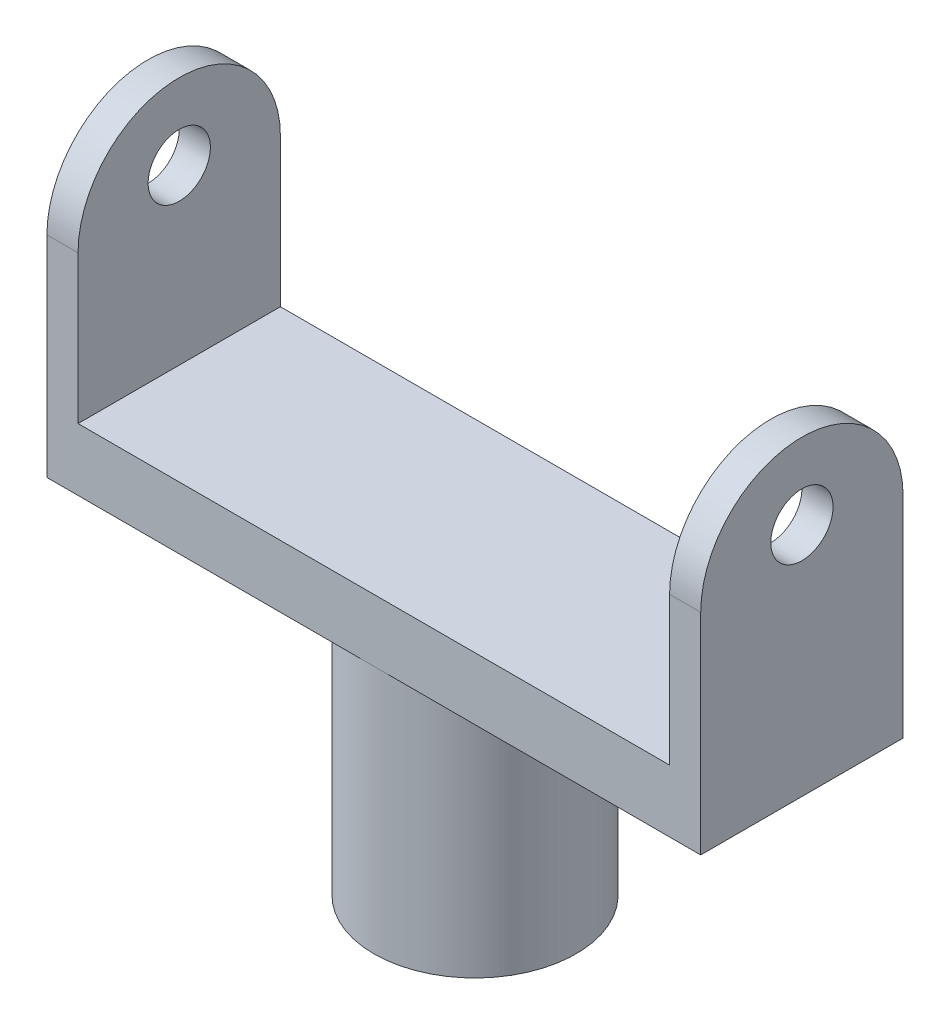
from build123d import *

# Parameters (mm, degrees)
SKETCH1_R               = 3.25
SKETCH1_R_2             = 2.75
BOSS_EXTRUDE1_DEPTH     = 8
SKETCH2_W               = 21
SKETCH2_H               = 6.5
BOSS_EXTRUDE2_DEPTH     = 2
SKETCH3_W               = 1
SKETCH3_H               = 6.5
BOSS_EXTRUDE3_DEPTH     = 8
CUT_EXTRUDE1_DEPTH      = 28.84892278
CUT_EXTRUDE1_DEPTH_BACK = 28.84892278
SKETCH4_R               = 1
FILLET1_RADIUS          = 3.25
FILLET1_LENGTH          = 1
FILLET2_RADIUS          = 3.25
FILLET2_LENGTH          = 1


with BuildPart() as part:
    # Sketch1 → Boss-Extrude1 (new body)
    with BuildSketch(Plane(origin=(0, 0, 0), x_dir=(1, 0, 0), z_dir=(0, 1, 0))):
        with Locations(Location((0, 0, 0), (0, 0, 270))):
            Circle(SKETCH1_R)
        with Locations(Location((0, 0, 0), (0, 0, 270))):
            Circle(SKETCH1_R_2, mode=Mode.SUBTRACT)
    extrude(amount=BOSS_EXTRUDE1_DEPTH)

    # Sketch2 → Boss-Extrude2 (add)
    with BuildSketch(Plane(origin=(0, 8, 0), x_dir=(1, 0, 0), z_dir=(0, 1, 0))):
        Rectangle(SKETCH2_W, SKETCH2_H)
    extrude(amount=BOSS_EXTRUDE2_DEPTH)

    # Sketch3 → Boss-Extrude3 (add)
    with BuildSketch(Plane(origin=(0, 10, 0), x_dir=(1, 0, 0), z_dir=(0, 1, 0))):
        with Locations((-10, 0)):
            Rectangle(SKETCH3_W, SKETCH3_H)
        with Locations((10, 0)):
            Rectangle(SKETCH3_W, SKETCH3_H)
    extrude(amount=BOSS_EXTRUDE3_DEPTH)

    # Sketch4 → Cut-Extrude1 (cut, two sides: drawn at the far end of the back side and taken through both)
    with BuildSketch(Plane.ZY.offset(10.5).offset(-CUT_EXTRUDE1_DEPTH_BACK)):
        with Locations((0, 15.56)):
            Circle(SKETCH4_R)
    extrude(amount=CUT_EXTRUDE1_DEPTH + CUT_EXTRUDE1_DEPTH_BACK, mode=Mode.SUBTRACT)

    # Fillet1: full round fillet: the end face becomes a half cylinder, R = half its width
    fillet1_face = Plane((10, 18, 0), x_dir=(-1, 0, 0), z_dir=(0, 1, 0))  # on the end face: x along it, z out of the body
    fillet1_slab = fillet1_face.offset(-FILLET1_RADIUS / 2) * Box(FILLET1_LENGTH, 2 * FILLET1_RADIUS, FILLET1_RADIUS, mode=Mode.PRIVATE)  # the body's end, R deep
    fillet1_round = Plane((10, 14.75, 0), x_dir=(0, 1, 0), z_dir=(-1, 0, 0)) * Cylinder(FILLET1_RADIUS, FILLET1_LENGTH, mode=Mode.PRIVATE)  # its axis R under the face
    add(fillet1_slab - fillet1_round, mode=Mode.SUBTRACT)

    # Fillet2: full round fillet: the end face becomes a half cylinder, R = half its width
    fillet2_face = Plane((-10, 18, 0), x_dir=(1, 0, 0), z_dir=(0, 1, 0))  # on the end face: x along it, z out of the body
    fillet2_slab = fillet2_face.offset(-FILLET2_RADIUS / 2) * Box(FILLET2_LENGTH, 2 * FILLET2_RADIUS, FILLET2_RADIUS, mode=Mode.PRIVATE)  # the body's end, R deep
    fillet2_round = Plane((-10, 14.75, 0), x_dir=(0, 1, 0), z_dir=(1, 0, 0)) * Cylinder(FILLET2_RADIUS, FILLET2_LENGTH, mode=Mode.PRIVATE)  # its axis R under the face
    add(fillet2_slab - fillet2_round, mode=Mode.SUBTRACT)


solid = part.part
